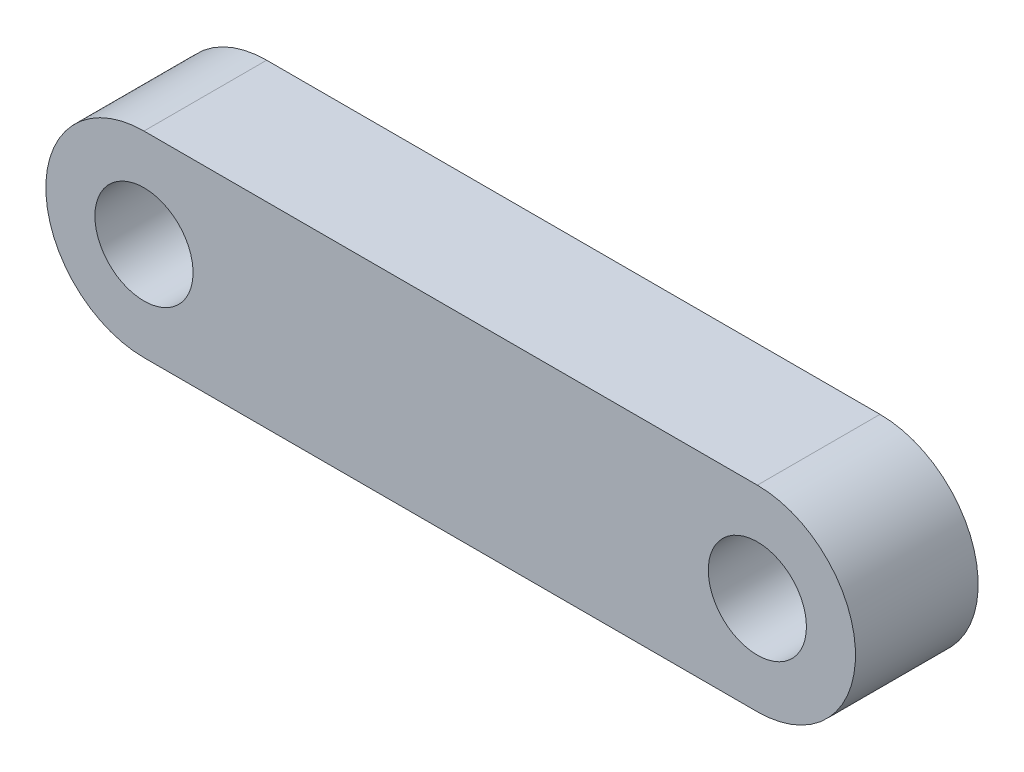
from build123d import *

# Parameters (mm, degrees)
SKETCH1_R           = 2
BOSS_EXTRUDE1_DEPTH = 5


with BuildPart() as part:
    # Sketch1 → Boss-Extrude1 (new body)
    with BuildSketch(Plane.XY):
        with BuildLine():
            Line((-12.5, 4), (12.5, 4))
            ThreePointArc((12.5, 4), (16.5, 0), (12.5, -4))
            Line((12.5, -4), (-12.5, -4))
            ThreePointArc((-12.5, -4), (-16.5, 0), (-12.5, 4))
        make_face()
        with Locations((12.5, 0)):
            Circle(SKETCH1_R, mode=Mode.SUBTRACT)
        with Locations(Location((-12.5, 0, 0), (0, 0, 180))):
            Circle(SKETCH1_R, mode=Mode.SUBTRACT)
    extrude(amount=BOSS_EXTRUDE1_DEPTH)


solid = part.part
